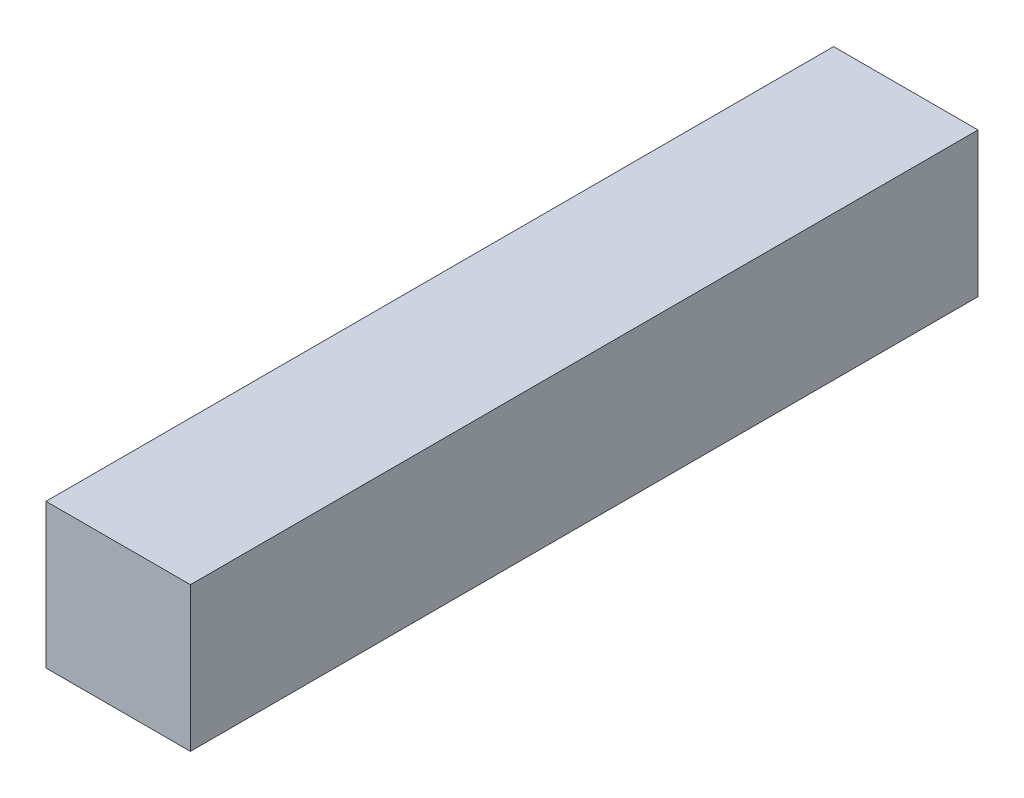
from build123d import *

# Parameters (mm, degrees)
SKETCH1_W           = 69.85
SKETCH1_H           = 69.85
BOSS_EXTRUDE1_DEPTH = 381
SKETCH1_3_W         = 57.15
SKETCH1_3_H         = 57.15
CUT_EXTRUDE1_DEPTH  = 374.65
SKETCH2_R           = 6.35
CUT_EXTRUDE2_DEPTH  = 6.35


with BuildPart() as part:
    # Sketch1 → Boss-Extrude1 (new body)
    with BuildSketch(Plane.XY):
        with Locations((28.575, 28.575)):
            Rectangle(SKETCH1_W, SKETCH1_H)
    extrude(amount=BOSS_EXTRUDE1_DEPTH)

    # Sketch1<3> → Cut-Extrude1 (cut)
    with BuildSketch(Plane.XY):
        with Locations((28.575, 28.575)):
            Rectangle(SKETCH1_3_W, SKETCH1_3_H)
    extrude(amount=CUT_EXTRUDE1_DEPTH, mode=Mode.SUBTRACT)

    # Sketch2 → Cut-Extrude2 (cut)
    with BuildSketch(Plane.XZ.offset(6.35)):
        with Locations(Location((28.575, 349.25, 0), (0, 0, 270))):
            Circle(SKETCH2_R)
    extrude(amount=-CUT_EXTRUDE2_DEPTH, mode=Mode.SUBTRACT)


solid = part.part
